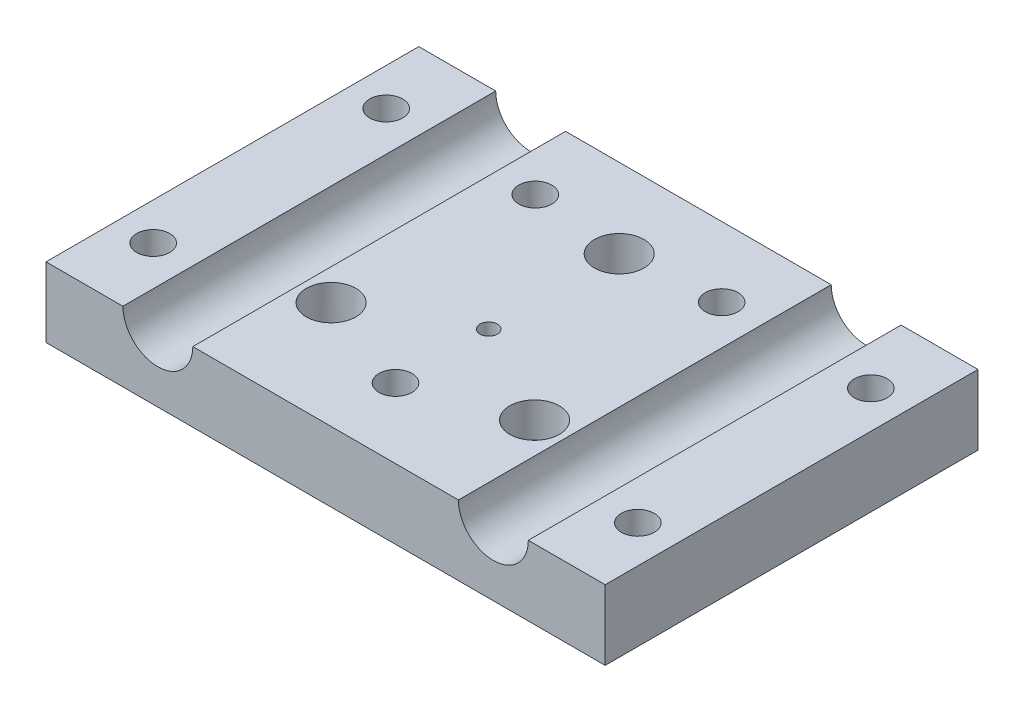
from build123d import *

# Parameters (mm, degrees)
SKETCH1_W               = 76.2
SKETCH1_H               = 50.8
BOSS_EXTRUDE1_DEPTH     = 9.525
F_1_4_CLEARANCE_HOLE1_D = 6.7564
CUT_EXTRUDE1_DEPTH      = 65.210401221
SKETCH5_R               = 1.190625
CUT_EXTRUDE2_DEPTH      = 47.770670564
F_8_CLEARANCE_HOLE1_D   = 4.4958
SKETCH8_R               = 5.08
CUT_EXTRUDE3_DEPTH      = 4.7625
SKETCH9_R               = 3.81
CUT_EXTRUDE4_DEPTH      = 4.7625


with BuildPart() as part:
    # Sketch1 → Boss-Extrude1 (new body)
    with BuildSketch(Plane(origin=(0, 0, 0), x_dir=(1, 0, 0), z_dir=(0, 1, 0))):
        Rectangle(SKETCH1_W, SKETCH1_H)
    extrude(amount=BOSS_EXTRUDE1_DEPTH)

    # 1/4 Clearance Hole1 (through all)
    with Locations(Plane(origin=(0, 9.525, 0), x_dir=(1, 0, 0), z_dir=(0, 1, 0))):
        with Locations((0, 14.61008), (-13.86078, -10.78992), (13.86078, -10.78992)):
            Hole(F_1_4_CLEARANCE_HOLE1_D / 2)

    # Sketch4 → Cut-Extrude1 (cut, through all)
    with BuildSketch(Plane.XY.offset(25.4)):
        with BuildLine():
            Line((-27.6225, 9.525), (-18.0975, 9.525))
            ThreePointArc((-18.0975, 9.525), (-22.86, 4.7625), (-27.6225, 9.525))
        make_face()
        with BuildLine():
            Line((18.0975, 9.525), (27.6225, 9.525))
            ThreePointArc((27.6225, 9.525), (22.86, 4.7625), (18.0975, 9.525))
        make_face()
    extrude(amount=-CUT_EXTRUDE1_DEPTH, mode=Mode.SUBTRACT)

    # Sketch5 → Cut-Extrude2 (cut, through all)
    with BuildSketch(Plane(origin=(0, 9.525, 0), x_dir=(1, 0, 0), z_dir=(0, 1, 0))):
        with Locations(Location((0, -3.175, 0), (0, 0, 270))):
            Circle(SKETCH5_R)
    extrude(amount=-CUT_EXTRUDE2_DEPTH, mode=Mode.SUBTRACT)

    # #8 Clearance Hole1 (through all)
    with Locations(Plane(origin=(0, 9.525, 0), x_dir=(1, 0, 0), z_dir=(0, 1, 0))):
        with Locations((-33.02, 15.875), (-33.02, -15.875), (33.02, -15.875), (33.02, 15.875), (-12.7, 15.875), (12.7, 15.875), (0, -15.875)):
            Hole(F_8_CLEARANCE_HOLE1_D / 2)

    # Sketch8 → Cut-Extrude3 (cut)
    with BuildSketch(Plane.XZ):
        with Locations(Location((-13.86078, 10.78992, 0), (0, 0, 270))):
            Circle(SKETCH8_R)
        with Locations(Location((13.86078, 10.78992, 0), (0, 0, 270))):
            Circle(SKETCH8_R)
        with Locations(Location((0, -14.61008, 0), (0, 0, 270))):
            Circle(SKETCH8_R)
    extrude(amount=-CUT_EXTRUDE3_DEPTH, mode=Mode.SUBTRACT)

    # Sketch9 → Cut-Extrude4 (cut)
    with BuildSketch(Plane.XZ):
        with Locations(Location((-33.02, 15.875, 0), (0, 0, 270))):
            Circle(SKETCH9_R)
        with Locations(Location((0, 15.875, 0), (0, 0, 270))):
            Circle(SKETCH9_R)
        with Locations(Location((33.02, 15.875, 0), (0, 0, 270))):
            Circle(SKETCH9_R)
        with Locations(Location((33.02, -15.875, 0), (0, 0, 270))):
            Circle(SKETCH9_R)
        with Locations(Location((12.7, -15.875, 0), (0, 0, 270))):
            Circle(SKETCH9_R)
        with Locations(Location((-12.7, -15.875, 0), (0, 0, 270))):
            Circle(SKETCH9_R)
        with Locations(Location((-33.02, -15.875, 0), (0, 0, 270))):
            Circle(SKETCH9_R)
    extrude(amount=-CUT_EXTRUDE4_DEPTH, mode=Mode.SUBTRACT)


solid = part.part
